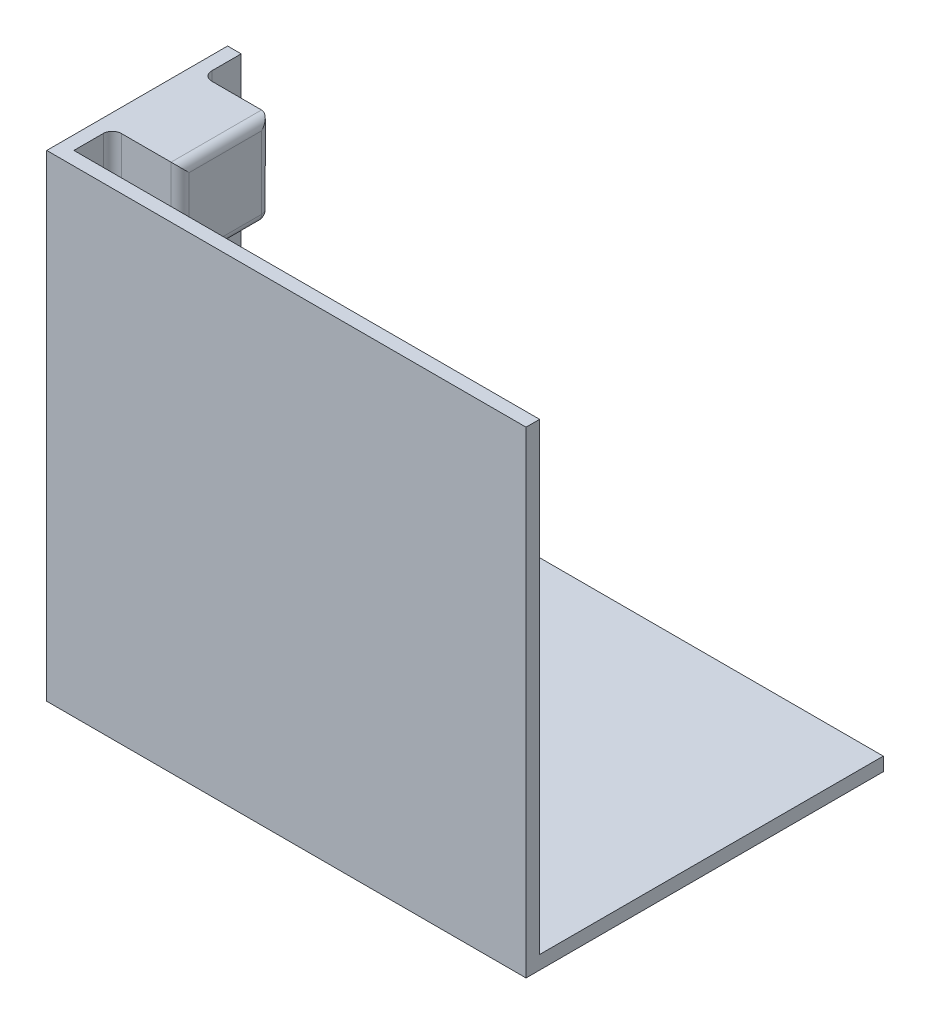
from build123d import *

# Parameters (mm, degrees)
SKETCH1_W                = 100
SKETCH1_H                = 73
BOSS_EXTRUDE1_DEPTH      = 3
BOSS_EXTRUDE2_DEPTH      = 102.5
BOSS_EXTRUDE2_DEPTH_BACK = 3
SKETCH2_W                = 106
SKETCH2_H                = 79
SKETCH2_W_2              = 100
SKETCH2_H_2              = 73
SKETCH3_W                = 106
SKETCH3_H                = 102.5
CUT_EXTRUDE1_DEPTH       = 39
CUT_EXTRUDE2_REACH       = 156.682
SKETCH4_W                = 37
SKETCH4_H                = 102.5
SKETCH5_W                = 20
SKETCH5_H                = 20
BOSS_EXTRUDE3_DEPTH      = 15
FILLET1_R                = 2


with BuildPart() as part:
    # Sketch1 → Boss-Extrude1 (new body)
    with BuildSketch(Plane(origin=(0, 0, 0), x_dir=(1, 0, 0), z_dir=(0, 1, 0))):
        Rectangle(SKETCH1_W, SKETCH1_H)
    extrude(amount=BOSS_EXTRUDE1_DEPTH)

    # Sketch2 → Boss-Extrude2 (add, two sides: drawn at the far end of the back side and taken through both)
    with BuildSketch(Plane(origin=(0, 3, 0), x_dir=(1, 0, 0), z_dir=(0, 1, 0)).offset(-BOSS_EXTRUDE2_DEPTH_BACK)):
        Rectangle(SKETCH2_W, SKETCH2_H)
        Rectangle(SKETCH2_W_2, SKETCH2_H_2, mode=Mode.SUBTRACT)
    extrude(amount=BOSS_EXTRUDE2_DEPTH + BOSS_EXTRUDE2_DEPTH_BACK)

    # Sketch3 → Cut-Extrude1 (cut)
    with BuildSketch(Plane(origin=(0, 0, -39.5), x_dir=(-1, 0, 0), z_dir=(0, 0, -1))):
        with Locations((0, 54.25)):
            Rectangle(SKETCH3_W, SKETCH3_H)
    extrude(amount=-CUT_EXTRUDE1_DEPTH, mode=Mode.SUBTRACT)

    # Sketch4 → Cut-Extrude2 (cut, up to next)
    with BuildSketch(Plane(origin=(53, 0, 0), x_dir=(0, 0, -1), z_dir=(1, 0, 0)), mode=Mode.PRIVATE) as cut_extrude2_sk1:
        with Locations((-18, 54.25)):
            Rectangle(SKETCH4_W, SKETCH4_H)
    cut_extrude2_tool1 = extrude(cut_extrude2_sk1.sketch, amount=-CUT_EXTRUDE2_REACH, mode=Mode.PRIVATE) & part.part
    add(cut_extrude2_tool1.solids().sort_by_distance((53, 54.25, 18))[0], mode=Mode.SUBTRACT)

    # Sketch5 → Boss-Extrude3 (add)
    with BuildSketch(Plane(origin=(-50, 0, 0), x_dir=(0, 0, -1), z_dir=(1, 0, 0))):
        with Locations((-18, 95.5)):
            Rectangle(SKETCH5_W, SKETCH5_H)
    extrude(amount=BOSS_EXTRUDE3_DEPTH)

    # Fillet1
    fillet1_edges = [part.edges().sort_by_distance(p)[0] for p in [
        (-50, 95.5, 8),
        (-42.5, 85.5, 8),
        (-50, 95.5, 28),
        (-50, 85.5, 18),
        (-42.5, 85.5, 28),
        (-35, 95.5, 8),
        (-35, 105.5, 18),
        (-35, 95.5, 28),
        (-35, 85.5, 18),
    ]]
    fillet(fillet1_edges, radius=FILLET1_R)


solid = part.part
